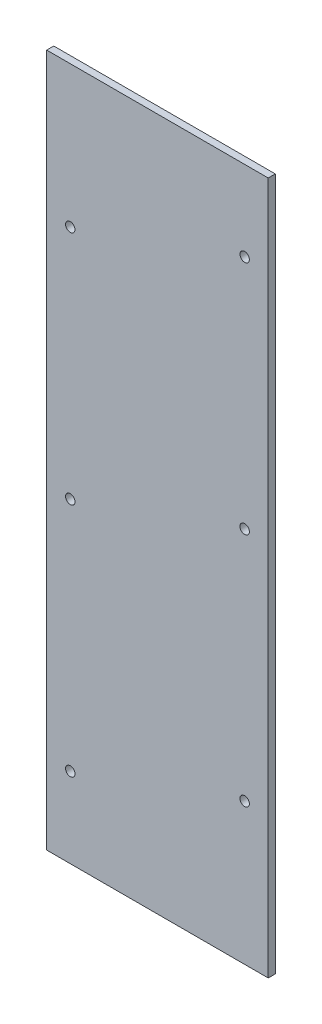
from build123d import *

# Parameters (mm, degrees)
SKETCH1_W           = 94
SKETCH1_H           = 294
BOSS_EXTRUDE1_DEPTH = 3
SKETCH2_R           = 2
CUT_EXTRUDE1_DEPTH  = 3


with BuildPart() as part:
    # Sketch1 → Boss-Extrude1 (new body)
    with BuildSketch(Plane.XY):
        Rectangle(SKETCH1_W, SKETCH1_H)
    extrude(amount=BOSS_EXTRUDE1_DEPTH)

    # Sketch2 → Cut-Extrude1 (cut)
    with BuildSketch(Plane.XY.offset(3)):
        with Locations((-37, -13)):
            Circle(SKETCH2_R)
        with Locations((-37, 87)):
            Circle(SKETCH2_R)
        with Locations((-37, -113)):
            Circle(SKETCH2_R)
        with Locations((37, -87)):
            Circle(SKETCH2_R)
        with Locations((37, 13)):
            Circle(SKETCH2_R)
        with Locations((37, 113)):
            Circle(SKETCH2_R)
    extrude(amount=-CUT_EXTRUDE1_DEPTH, mode=Mode.SUBTRACT)


solid = part.part
